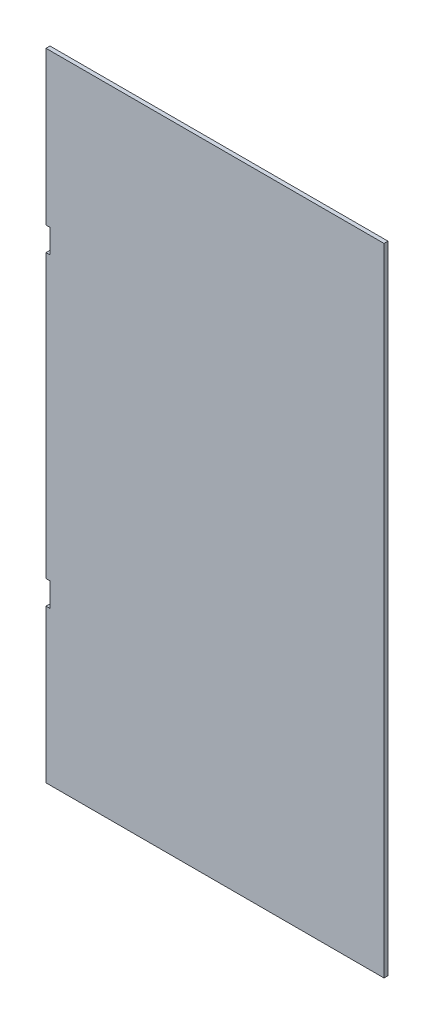
from build123d import *

# Parameters (mm, degrees)
ESQUISSE1_W             = 400
ESQUISSE1_H             = 800
BOSS_EXTRU_1_DEPTH      = 5
ESQUISSE2_W             = 5
ESQUISSE2_H             = 30
ENL_V_MAT_EXTRU_1_DEPTH = 5
ESQUISSE3_W             = 5
ESQUISSE3_H             = 800
BOSS_EXTRU_2_DEPTH      = 25


with BuildPart() as part:
    # Esquisse1 → Boss.-Extru.1 (new body)
    with BuildSketch(Plane.XY):
        Rectangle(ESQUISSE1_W, ESQUISSE1_H)
    extrude(amount=BOSS_EXTRU_1_DEPTH)

    # Esquisse2 → Enlèv. mat.-Extru.1 (cut)
    with BuildSketch(Plane.XY.offset(5)):
        with Locations((-197.5, 192.5)):
            Rectangle(ESQUISSE2_W, ESQUISSE2_H)
        with Locations((-197.5, -192.5)):
            Rectangle(ESQUISSE2_W, ESQUISSE2_H)
    extrude(amount=-ENL_V_MAT_EXTRU_1_DEPTH, mode=Mode.SUBTRACT)

    # Esquisse3 → Boss.-Extru.2 (add)
    with BuildSketch(Plane(origin=(200, 0, 0), x_dir=(0, 0, -1), z_dir=(1, 0, 0))):
        with Locations((-2.5, 0)):
            Rectangle(ESQUISSE3_W, ESQUISSE3_H)
    extrude(amount=BOSS_EXTRU_2_DEPTH)


solid = part.part
